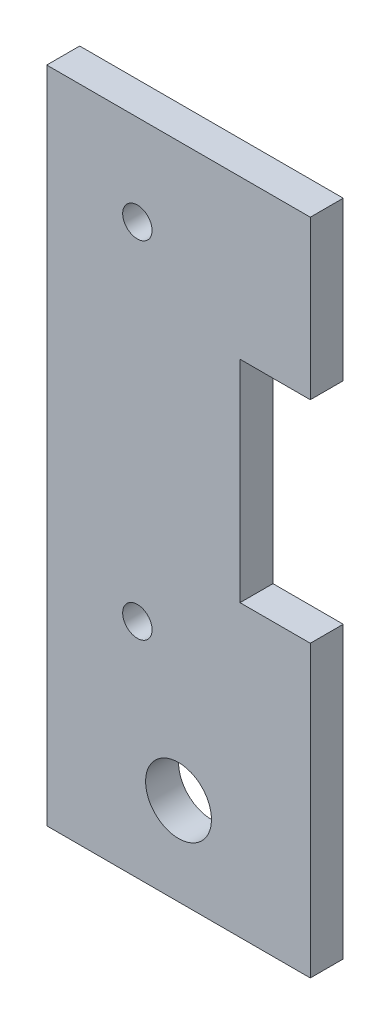
from build123d import *

# Parameters (mm, degrees)
SKETCH2_W           = 38.1
SKETCH2_H           = 95.25
BOSS_EXTRUDE1_DEPTH = 4.7625
SKETCH3_R           = 2.125
SKETCH3_R_2         = 4.7625
SKETCH3_W           = 10.16
SKETCH3_H           = 30.48
CUT_EXTRUDE3_DEPTH  = 69.850663804


with BuildPart() as part:
    # Sketch2 → Boss-Extrude1 (new body)
    with BuildSketch(Plane.XY):
        with Locations((-19.05, -9.525)):
            Rectangle(SKETCH2_W, SKETCH2_H)
    extrude(amount=BOSS_EXTRUDE1_DEPTH)

    # Sketch3 → Cut-Extrude3 (cut, through all)
    with BuildSketch(Plane.XY):
        with Locations(Location((-25, 25, 0), (0, 0, 180))):
            Circle(SKETCH3_R)
        with Locations((25, 25)):
            Circle(SKETCH3_R)
        with Locations((25, -25)):
            Circle(SKETCH3_R)
        with Locations(Location((-25, -25, 0), (0, 0, 180))):
            Circle(SKETCH3_R)
        with Locations(Location((-19.05, -44.45, 0), (0, 0, 180))):
            Circle(SKETCH3_R_2)
        with Locations((-5.08, 0)):
            Rectangle(SKETCH3_W, SKETCH3_H)
    extrude(amount=CUT_EXTRUDE3_DEPTH, mode=Mode.SUBTRACT)


solid = part.part
